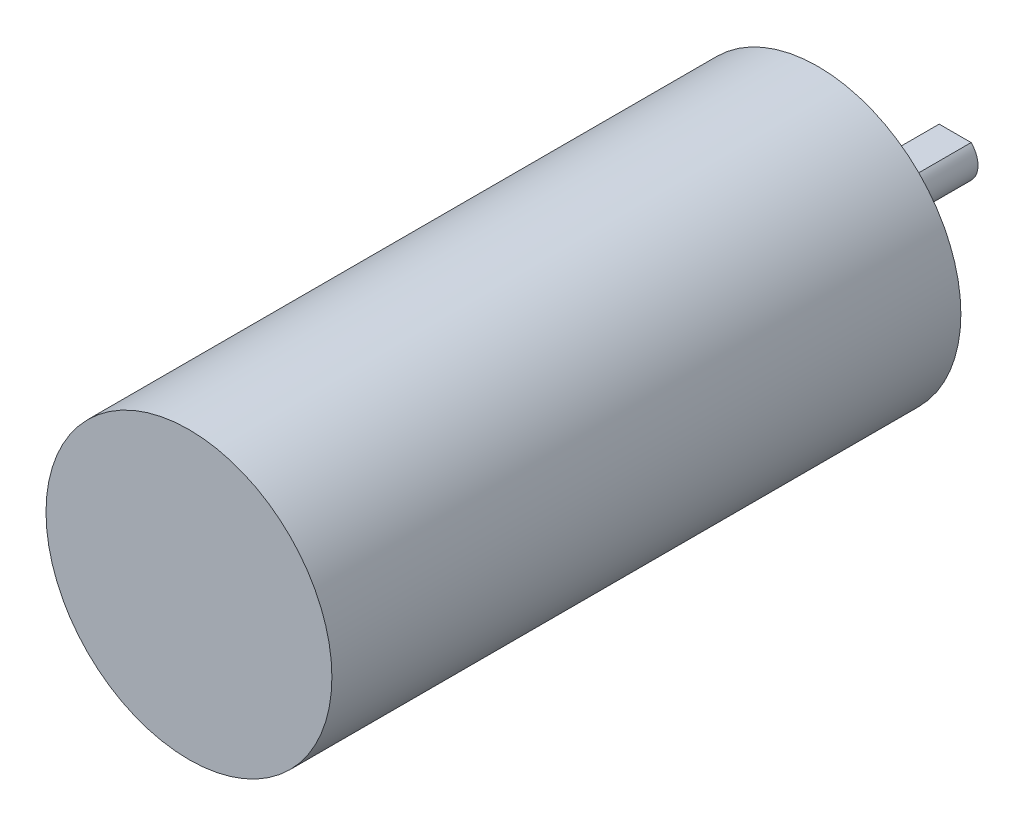
from build123d import *

# Parameters (mm, degrees)
SKETCH2_R           = 12.5
BOSS_EXTRUDE1_DEPTH = 55
BOSS_EXTRUDE2_DEPTH = 12


with BuildPart() as part:
    # Sketch2 → Boss-Extrude1 (new body)
    with BuildSketch(Plane.XY):
        Circle(SKETCH2_R)
    extrude(amount=BOSS_EXTRUDE1_DEPTH)

    # Sketch3 → Boss-Extrude2 (add)
    with BuildSketch(Plane(origin=(0, 0, 0), x_dir=(-1, 0, 0), z_dir=(0, 0, -1))):
        with BuildLine():
            Line((-1.398248905, 1.43), (1.398248905, 1.43))
            ThreePointArc((1.398248905, 1.43), (0, -2), (-1.398248905, 1.43))
        make_face()
    extrude(amount=BOSS_EXTRUDE2_DEPTH)


solid = part.part
